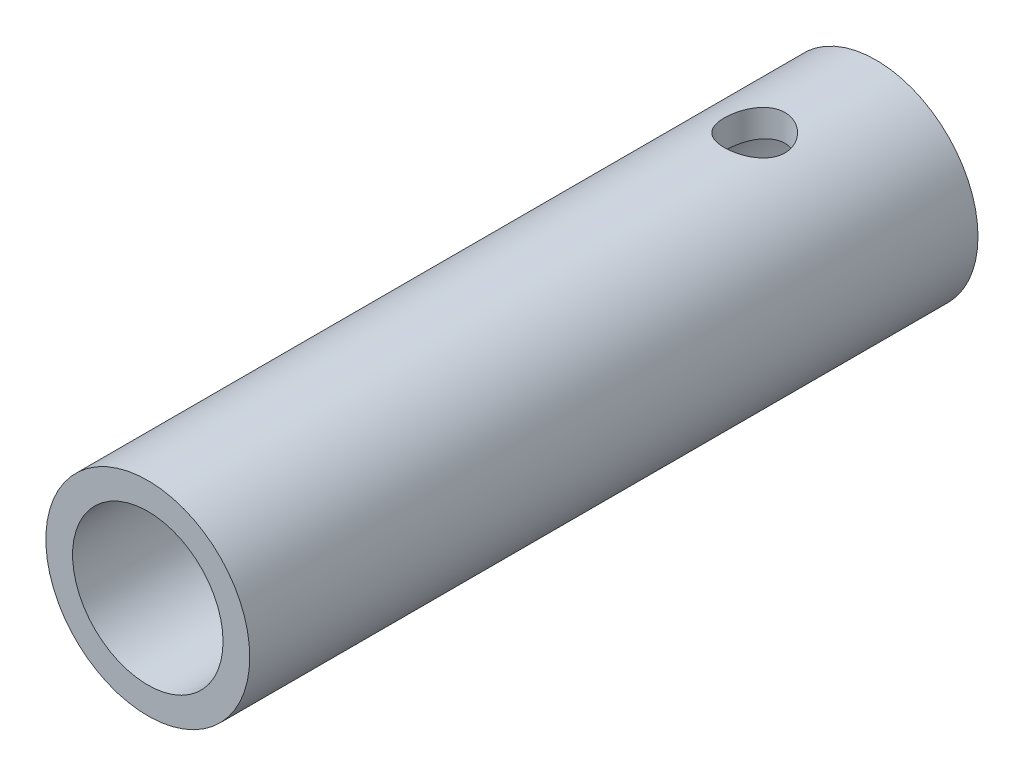
from build123d import *

# Parameters (mm, degrees)
SKETCH1_R           = 10.668
SKETCH1_R_2         = 7.874
BOSS_EXTRUDE1_DEPTH = 76.2
SKETCH3_R           = 3.175
CUT_EXTRUDE1_DEPTH  = 26.9


with BuildPart() as part:
    # Sketch1 → Boss-Extrude1 (new body)
    with BuildSketch(Plane.XY):
        with Locations(Location((0, 0, 0), (0, 0, 180))):
            Circle(SKETCH1_R)
        with Locations(Location((0, 0, 0), (0, 0, 180))):
            Circle(SKETCH1_R_2, mode=Mode.SUBTRACT)
    extrude(amount=BOSS_EXTRUDE1_DEPTH)

    # Sketch3 → Cut-Extrude1 (cut)
    with BuildSketch(Plane(origin=(0, 0, 0), x_dir=(1, 0, 0), z_dir=(0, 1, 0))):
        with Locations(Location((0, -12.7, 0), (0, 0, 90))):
            Circle(SKETCH3_R)
    extrude(amount=CUT_EXTRUDE1_DEPTH, mode=Mode.SUBTRACT)


solid = part.part
